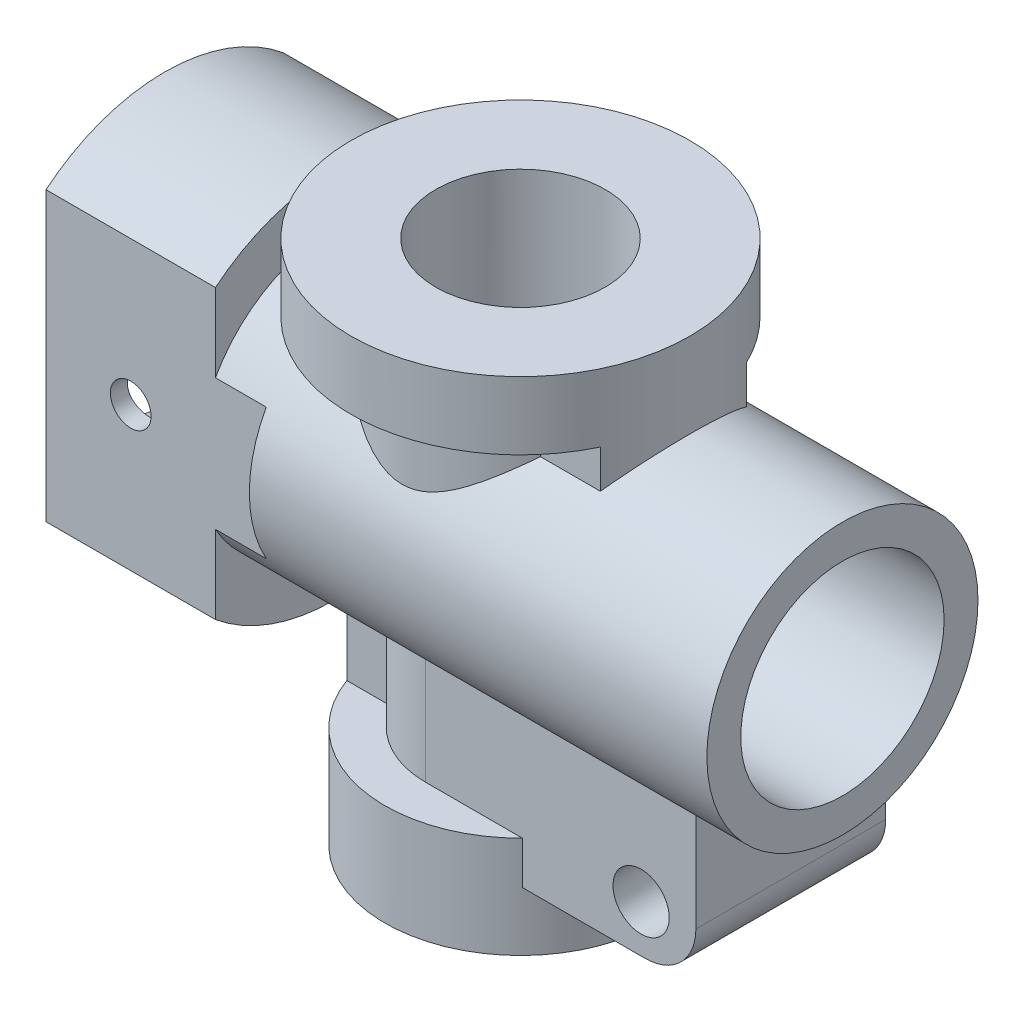
from build123d import *
from build123d.topology import SkipClean

# Parameters (mm, degrees)
SKETCH_1_R                       = 40
EXTRUDE_1_DEPTH                  = 150
SKETCH_2_R                       = 55
EXTRUDE_2_DEPTH                  = 50
SKETCH_3_R                       = 30
CUT_EXTRUDE_2_DEPTH              = 200
CUT_EXTRUDE_3_DEPTH              = 134
CUT_EXTRUDE_3_DEPTH_BACK         = 106
SKETCH_5_R                       = 6
EXTRUDE_3_DEPTH                  = 45
SKETCH_15_R                      = 50
EXTRUDE_5_DEPTH                  = 20
EXTRUDE_6_DEPTH                  = 59.991870163
SKETCH_17_R                      = 40
EXTRUDE_7_DEPTH                  = 30
SKETCH_18_R                      = 26
CUT_EXTRUDE_25_DEPTH             = 30
SKETCH_19_R                      = 17
CUT_EXTRUDE_26_DEPTH             = 51
CUT_EXTRUDE_27_DEPTH             = 170
CUT_EXTRUDE_27_DEPTH_BACK        = 99
SKETCH_20_R                      = 30
SKETCH_21_R                      = 25
CUT_EXTRUDE_28_DEPTH             = 60
EXTRUDE_8_DEPTH                  = 28
EXTRUDE_8_DEPTH_BACK             = 28
SKETCH_23_R                      = 8.294671539
CUT_EXTRUDE_29_DEPTH             = 70
CUT_EXTRUDE_30_REACH             = 185.367
CUT_EXTRUDE_30_END_RADIUS        = 55
SKETCH_24_W                      = 85
SKETCH_24_H                      = 25
CUT_EXTRUDE_30_DIRECTION_2_DEPTH = 70
CUT_EXTRUDE_31_DEPTH             = 70
CUT_EXTRUDE_31_DEPTH_BACK        = 70
SKETCH_25_W                      = 85
SKETCH_25_H                      = 25
SKETCH_26_R                      = 26
CUT_EXTRUDE_32_DEPTH             = 30
SKETCH_27_R                      = 17
CUT_EXTRUDE_33_DEPTH             = 55
CUT_EXTRUDE_34_DEPTH             = 417
CUT_EXTRUDE_34_DEPTH_BACK        = 195
SKETCH_29_R                      = 30


with BuildPart() as part:
    # 草图1 → 凸台-拉伸1 (new body)
    with BuildSketch(Plane(origin=(0, 0, 0), x_dir=(0, 0, -1), z_dir=(1, 0, 0))):
        Circle(SKETCH_1_R)
    extrude(amount=EXTRUDE_1_DEPTH)

    # 草图2 → 凸台-拉伸2 (add)
    with BuildSketch(Plane(origin=(0, 0, 0), x_dir=(0, 0, -1), z_dir=(1, 0, 0))):
        Circle(SKETCH_2_R)
    extrude(amount=-EXTRUDE_2_DEPTH)

    # 草图3 → 切除-拉伸2 (cut)
    with BuildSketch(Plane(origin=(150, 0, 0), x_dir=(0, 0, -1), z_dir=(1, 0, 0))):
        Circle(SKETCH_3_R)
    extrude(amount=-CUT_EXTRUDE_2_DEPTH, mode=Mode.SUBTRACT)

    # 草图5 → 切除-拉伸3 (cut, two sides: drawn at the far end of the back side and taken through both)
    with BuildSketch(Plane.XY.offset(-CUT_EXTRUDE_3_DEPTH_BACK)):
        with Locations((-25, 0)):
            Circle(SKETCH_5_R)
    extrude(amount=CUT_EXTRUDE_3_DEPTH + CUT_EXTRUDE_3_DEPTH_BACK, mode=Mode.SUBTRACT)

    # 草图7 → 凸台-拉伸3 (add)
    with BuildSketch(Plane(origin=(0, 0, 0), x_dir=(1, 0, 0), z_dir=(0, 1, 0))):
        with BuildLine():
            Line((82.442023832, 21.548591956), (100.118268858, 21.548591956))
            ThreePointArc((100.118268858, 21.548591956), (105, 0), (100.118268858, -21.548591956))
            Line((100.118268858, -21.548591956), (82.442023832, -21.548591956))
            ThreePointArc((82.442023832, -21.548591956), (55, -34.891352615), (27.557976168, -21.548591956))
            Line((27.557976168, -21.548591956), (9.881731142, -21.548591956))
            ThreePointArc((9.881731142, -21.548591956), (5, 0), (9.881731142, 21.548591956))
            Line((9.881731142, 21.548591956), (27.557976168, 21.548591956))
            ThreePointArc((27.557976168, 21.548591956), (55, 34.891352615), (82.442023832, 21.548591956))
        make_face()
    extrude(amount=EXTRUDE_3_DEPTH)

    # 草图15 → 凸台-拉伸5 (add)
    with SkipClean():  # the faces are left unmerged after this step: merging them gives an invalid solid
        with BuildSketch(Plane(origin=(0, 45, 0), x_dir=(1, 0, 0), z_dir=(0, 1, 0))):
            with Locations(Location((55, 0, 0), (0, 0, 154.470748686))):
                Circle(SKETCH_15_R)
        extrude(amount=EXTRUDE_5_DEPTH)

    # 草图16 → 凸台-拉伸6 (add)
    with SkipClean():  # the faces are left unmerged after this step: merging them gives an invalid solid
        with BuildSketch(Plane(origin=(0, 0, 0), x_dir=(1, 0, 0), z_dir=(0, 1, 0))):
            with BuildLine():
                Line((30.539216555, 13.626080627), (17.392421951, 13.626080627))
                ThreePointArc((17.392421951, 13.626080627), (15, 0), (17.392421951, -13.626080627))
                Line((17.392421951, -13.626080627), (30.539216555, -13.626080627))
                ThreePointArc((30.539216555, -13.626080627), (55, -28), (79.460783445, -13.626080627))
                Line((79.460783445, -13.626080627), (92.607578049, -13.626080627))
                ThreePointArc((92.607578049, -13.626080627), (95, 0), (92.607578049, 13.626080627))
                Line((92.607578049, 13.626080627), (79.460783445, 13.626080627))
                ThreePointArc((79.460783445, 13.626080627), (55, 28), (30.539216555, 13.626080627))
            make_face()
        extrude(amount=-EXTRUDE_6_DEPTH)

    # 草图17 → 凸台-拉伸7 (add)
    with BuildSketch(Plane.XZ.offset(59.991870163)):
        with Locations(Location((55, 0, 0), (0, 0, 19.916603358))):
            Circle(SKETCH_17_R)
    extrude(amount=EXTRUDE_7_DEPTH)

    # 草图18 → 切除-拉伸25 (cut)
    with BuildSketch(Plane.XZ.offset(89.991870163)):
        with Locations(Location((55, 0, 0), (0, 0, 270))):
            Circle(SKETCH_18_R)
    extrude(amount=-CUT_EXTRUDE_25_DEPTH, mode=Mode.SUBTRACT)

    # 草图19 → 切除-拉伸26 (cut)
    with BuildSketch(Plane.XZ.offset(59.991870163)):
        with Locations(Location((55, 0, 0), (0, 0, 270))):
            Circle(SKETCH_19_R)
    extrude(amount=-CUT_EXTRUDE_26_DEPTH, mode=Mode.SUBTRACT)

    # 草图20 → 切除-拉伸27 (cut, two sides: drawn at the far end of the back side and taken through both)
    with BuildSketch(Plane(origin=(0, 0, 0), x_dir=(0, 0, -1), z_dir=(1, 0, 0)).offset(-CUT_EXTRUDE_27_DEPTH_BACK)):
        Circle(SKETCH_20_R)
    extrude(amount=CUT_EXTRUDE_27_DEPTH + CUT_EXTRUDE_27_DEPTH_BACK, mode=Mode.SUBTRACT)

    # 草图21 → 切除-拉伸28 (cut)
    with BuildSketch(Plane(origin=(0, 65, 0), x_dir=(1, 0, 0), z_dir=(0, 1, 0))):
        with Locations(Location((55, 0, 0), (0, 0, 270))):
            Circle(SKETCH_21_R)
    extrude(amount=-CUT_EXTRUDE_28_DEPTH, mode=Mode.SUBTRACT)

    # 草图22 → 凸台-拉伸8 (add, two sides: drawn at the far end of the back side and taken through both)
    with BuildSketch(Plane.XY.offset(-EXTRUDE_8_DEPTH_BACK)):
        with BuildLine():
            Line((119.756495452, -72.615787856), (55, -72.615787856))
            Line((55, -72.615787856), (55, -17.615787856))
            Line((55, -17.615787856), (134.756495452, -17.615787856))
            Line((134.756495452, -17.615787856), (134.756495452, -57.615787856))
            ThreePointArc((134.756495452, -57.615787856), (130.36309717, -68.222389574), (119.756495452, -72.615787856))
        make_face()
    extrude(amount=EXTRUDE_8_DEPTH + EXTRUDE_8_DEPTH_BACK)

    # 草图23 → 切除-拉伸29 (cut)
    with BuildSketch(Plane.XY.offset(28)):
        with Locations((118.599166742, -58.702167389)):
            Circle(SKETCH_23_R)
    extrude(amount=-CUT_EXTRUDE_29_DEPTH, mode=Mode.SUBTRACT)

    # 切除-拉伸30: up to this cylinder (the profile starts inside it)
    cut_extrude_30_end = Plane(origin=(-27.5, 0, 0), z_dir=(1, 0, 0)) * Cylinder(CUT_EXTRUDE_30_END_RADIUS, 481.734, mode=Mode.PRIVATE)
    # 草图24 → 切除-拉伸30 (cut, up to the surface)
    with BuildSketch(Plane(origin=(0, 0, 0), x_dir=(1, 0, 0), z_dir=(0, 1, 0)), mode=Mode.PRIVATE) as cut_extrude_30_sk1:
        with Locations((-27.5, -47.5)):
            Rectangle(SKETCH_24_W, SKETCH_24_H)
    cut_extrude_30_tool1 = extrude(cut_extrude_30_sk1.sketch, amount=-CUT_EXTRUDE_30_REACH, mode=Mode.PRIVATE) & cut_extrude_30_end
    add(cut_extrude_30_tool1.solids().sort_by_distance((-27.5, 0, 47.5))[0], mode=Mode.SUBTRACT)

    # 草图24 → 切除-拉伸30 direction 2 (cut)
    with BuildSketch(Plane(origin=(0, 0, 0), x_dir=(1, 0, 0), z_dir=(0, 1, 0))):
        with Locations((-27.5, -47.5)):
            Rectangle(SKETCH_24_W, SKETCH_24_H)
    extrude(amount=CUT_EXTRUDE_30_DIRECTION_2_DEPTH, mode=Mode.SUBTRACT)

    # 草图25 → 切除-拉伸31 (cut, two sides: drawn at the far end of the back side and taken through both)
    with BuildSketch(Plane(origin=(0, 0, 0), x_dir=(1, 0, 0), z_dir=(0, 1, 0)).offset(-CUT_EXTRUDE_31_DEPTH_BACK)):
        with Locations((-27.5, 47.5)):
            Rectangle(SKETCH_25_W, SKETCH_25_H)
    extrude(amount=CUT_EXTRUDE_31_DEPTH + CUT_EXTRUDE_31_DEPTH_BACK, mode=Mode.SUBTRACT)

    # 草图26 → 切除-拉伸32 (cut)
    with BuildSketch(Plane.XZ.offset(89.991870163)):
        with Locations(Location((55, 0, 0), (0, 0, 270))):
            Circle(SKETCH_26_R)
    extrude(amount=-CUT_EXTRUDE_32_DEPTH, mode=Mode.SUBTRACT)

    # 草图27 → 切除-拉伸33 (cut)
    with BuildSketch(Plane.XZ.offset(59.991870163)):
        with Locations(Location((55, 0, 0), (0, 0, 270))):
            Circle(SKETCH_27_R)
    extrude(amount=-CUT_EXTRUDE_33_DEPTH, mode=Mode.SUBTRACT)

    # 草图29 → 切除-拉伸34 (cut, two sides: drawn at the far end of the back side and taken through both)
    with BuildSketch(Plane(origin=(0, 0, 0), x_dir=(0, 0, -1), z_dir=(1, 0, 0)).offset(-CUT_EXTRUDE_34_DEPTH_BACK)):
        Circle(SKETCH_29_R)
    extrude(amount=CUT_EXTRUDE_34_DEPTH + CUT_EXTRUDE_34_DEPTH_BACK, mode=Mode.SUBTRACT)


solid = part.part
